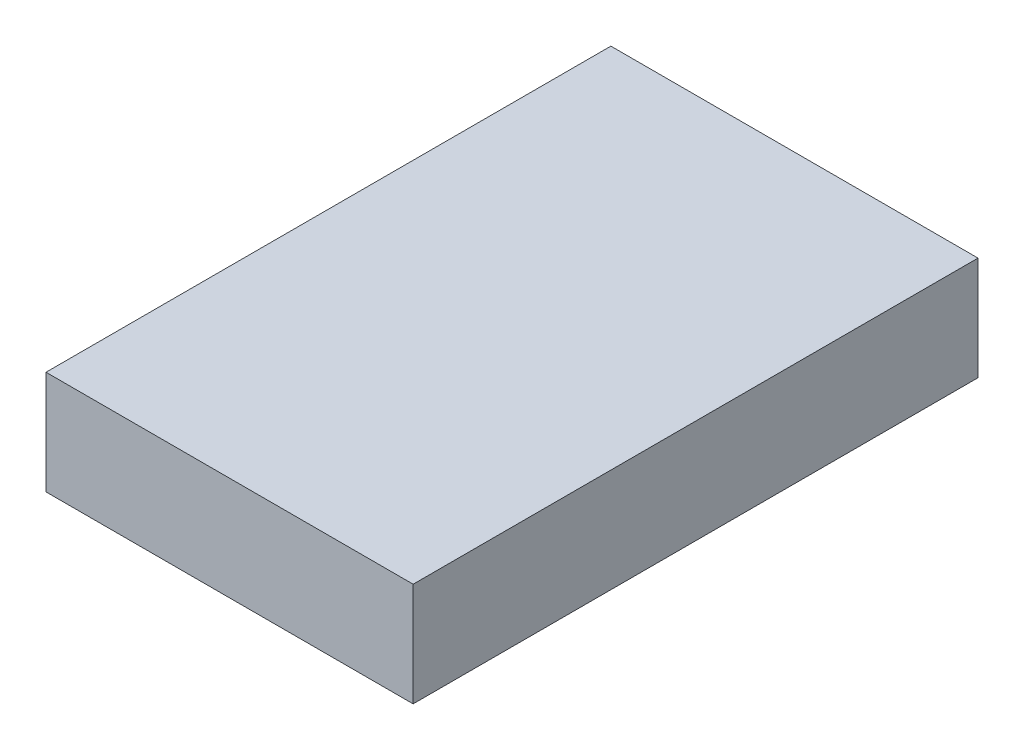
from build123d import *

# Parameters (mm, degrees)
SKETCH3_W           = 129.99974
SKETCH3_H           = 200.0047816
BOSS_EXTRUDE1_DEPTH = 36.7000028


with BuildPart() as part:
    # Sketch3 → Boss-Extrude1 (new body)
    with BuildSketch(Plane(origin=(0, 0, 0), x_dir=(1, 0, 0), z_dir=(0, 1, 0))):
        with Locations((-64.456415833, -99.407342883)):
            Rectangle(SKETCH3_W, SKETCH3_H)
    extrude(amount=BOSS_EXTRUDE1_DEPTH)


solid = part.part
